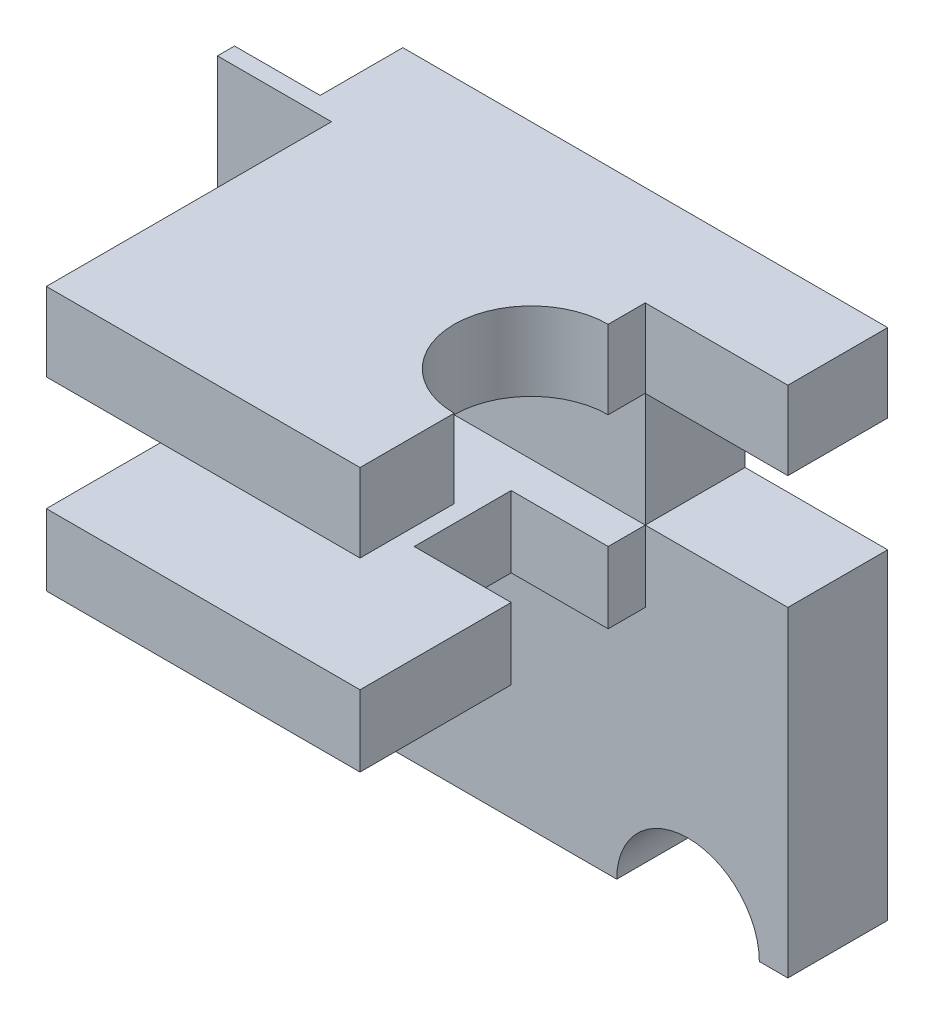
from build123d import *

# Parameters (mm, degrees)
SKETCH_1_W          = 200
SKETCH_1_H          = 180
EXTRUDE_3_DEPTH     = 35
SKETCH_1_3_W        = 50
SKETCH_1_3_H        = 40
CUT_EXTRUDE_2_DEPTH = 140.014387745
SKETCH_4_W          = 110
SKETCH_4_H          = 100
EXTRUDE_4_DEPTH     = 27.474741722
EXTRUDE_START       = -67.474742
SKETCH_4_4_W        = 110
SKETCH_4_4_H        = 100
EXTRUDE_5_DEPTH     = 25
SKETCH_9_W          = 30
SKETCH_9_H          = 29
CUT_EXTRUDE_5_DEPTH = 247.221445045
CUT_EXTRUDE_6_DEPTH = 27.474741722
SKETCH_11_W         = 34
SKETCH_11_H         = 34
CUT_EXTRUDE_7_DEPTH = 25


with BuildPart() as part:
    # Эскиз1 → Бобышка-Вытянуть3 (new body)
    with BuildSketch(Plane.XY):
        Rectangle(SKETCH_1_W, SKETCH_1_H)
    extrude(amount=EXTRUDE_3_DEPTH)

    # Эскиз1<3> → Вырез-Вытянуть2 (cut, through all)
    with BuildSketch(Plane.XY):
        with BuildLine():
            ThreePointArc((40, -90), (65, -65), (90, -90))
            Line((90, -90), (40, -90))
        make_face()
        with Locations((75, 42.525258278)):
            Rectangle(SKETCH_1_3_W, SKETCH_1_3_H)
    extrude(amount=CUT_EXTRUDE_2_DEPTH, mode=Mode.SUBTRACT)

    # Эскиз4 → Бобышка-Вытянуть4 (add)
    with BuildSketch(Plane(origin=(0, 90, 0), x_dir=(1, 0, 0), z_dir=(0, 1, 0))):
        with Locations((-5, -85)):
            Rectangle(SKETCH_4_W, SKETCH_4_H)
    extrude(amount=-EXTRUDE_4_DEPTH)

    # Эскиз4<4> → Бобышка-Вытянуть5 (add)
    with BuildSketch(Plane(origin=(0, 90, 0), x_dir=(1, 0, 0), z_dir=(0, 1, 0)).offset(EXTRUDE_START)):
        with Locations((-5, -85)):
            Rectangle(SKETCH_4_4_W, SKETCH_4_4_H)
    extrude(amount=-EXTRUDE_5_DEPTH)

    # Эскиз9 → Вырез-Вытянуть5 (cut, through all)
    with BuildSketch(Plane(origin=(0, 90, 0), x_dir=(1, 0, 0), z_dir=(0, 1, 0))):
        with Locations((-85, -14.5)):
            Rectangle(SKETCH_9_W, SKETCH_9_H)
    extrude(amount=-CUT_EXTRUDE_5_DEPTH, mode=Mode.SUBTRACT)

    # Эскиз10 → Вырез-Вытянуть6 (cut)
    with BuildSketch(Plane(origin=(0, 90, 0), x_dir=(1, 0, 0), z_dir=(0, 1, 0))):
        with BuildLine():
            Line((50, -48), (50, -102))
            ThreePointArc((50, -102), (23, -75), (50, -48))
        make_face()
    extrude(amount=-CUT_EXTRUDE_6_DEPTH, mode=Mode.SUBTRACT)

    # Эскиз11 → Вырез-Вытянуть7 (cut)
    with BuildSketch(Plane.XZ.offset(2.474741722)):
        with Locations((33, 65)):
            Rectangle(SKETCH_11_W, SKETCH_11_H)
    extrude(amount=-CUT_EXTRUDE_7_DEPTH, mode=Mode.SUBTRACT)


solid = part.part
